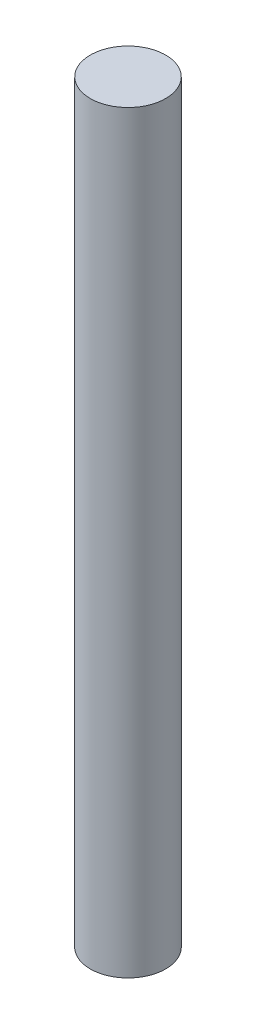
from build123d import *

# Parameters (mm, degrees)
SKETCH1_R           = 2.5
BOSS_EXTRUDE1_DEPTH = 25


with BuildPart() as part:
    # Sketch1 → Boss-Extrude1 (new, symmetric)
    with BuildSketch(Plane(origin=(0, 0, 0), x_dir=(1, 0, 0), z_dir=(0, 1, 0))):
        with Locations(Location((0, 0, 0), (0, 0, 270))):
            Circle(SKETCH1_R)
    extrude(amount=BOSS_EXTRUDE1_DEPTH, both=True)


solid = part.part
